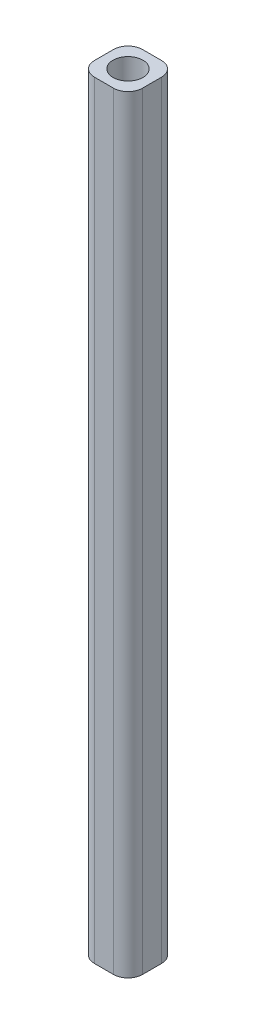
from build123d import *

# Parameters (mm, degrees)
SKETCH1_W           = 10
SKETCH1_H           = 10
BOSS_EXTRUDE1_DEPTH = 160
FILLET1_R           = 3
SKETCH2_R           = 3.125
CUT_EXTRUDE1_DEPTH  = 4.7
CUT_EXTRUDE2_START  = -160
SKETCH2_2_R         = 3.125
CUT_EXTRUDE2_DEPTH  = 4.7


with BuildPart() as part:
    # Sketch1 → Boss-Extrude1 (new body)
    with BuildSketch(Plane(origin=(0, 0, 0), x_dir=(1, 0, 0), z_dir=(0, 1, 0))):
        Rectangle(SKETCH1_W, SKETCH1_H)
    extrude(amount=BOSS_EXTRUDE1_DEPTH)

    # Fillet1
    fillet1_edges = [part.edges().sort_by_distance(p)[0] for p in [
        (-5, 80, -5),
        (5, 80, -5),
        (5, 80, 5),
        (-5, 80, 5),
    ]]
    fillet(fillet1_edges, radius=FILLET1_R)

    # Sketch2 → Cut-Extrude1 (cut)
    with BuildSketch(Plane(origin=(0, 160, 0), x_dir=(1, 0, 0), z_dir=(0, 1, 0))):
        with Locations(Location((0, 0, 0), (0, 0, 270))):
            Circle(SKETCH2_R)
    extrude(amount=-CUT_EXTRUDE1_DEPTH, mode=Mode.SUBTRACT)

    # Sketch2<2> → Cut-Extrude2 (cut)
    with BuildSketch(Plane(origin=(0, 160, 0), x_dir=(1, 0, 0), z_dir=(0, 1, 0)).offset(CUT_EXTRUDE2_START)):
        with Locations(Location((0, 0, 0), (0, 0, 270))):
            Circle(SKETCH2_2_R)
    extrude(amount=CUT_EXTRUDE2_DEPTH, mode=Mode.SUBTRACT)


solid = part.part
